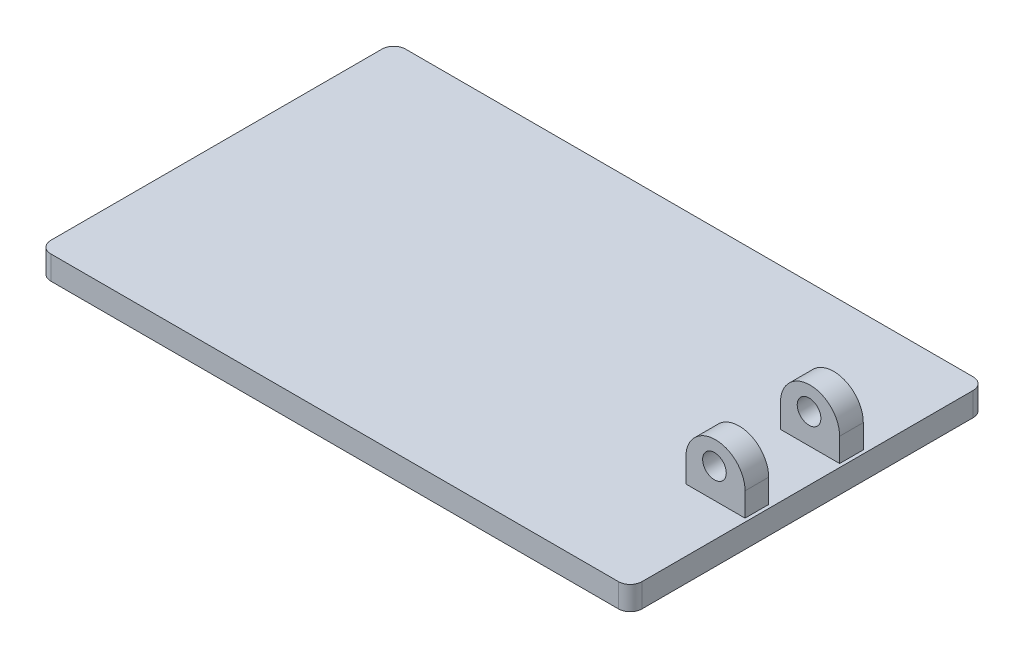
from build123d import *

# Parameters (mm, degrees)
SKETCH1_W           = 500
SKETCH1_H           = 300
BOSS_EXTRUDE1_DEPTH = 20
BOSS_EXTRUDE2_START = -100
BOSS_EXTRUDE2_DEPTH = 20
SKETCH3_R           = 10
CUT_EXTRUDE1_DEPTH  = 286
FILLET1_R           = 10


with BuildPart() as part:
    # Sketch1 → Boss-Extrude1 (new body)
    with BuildSketch(Plane(origin=(0, 0, 0), x_dir=(1, 0, 0), z_dir=(0, 1, 0))):
        Rectangle(SKETCH1_W, SKETCH1_H)
    extrude(amount=BOSS_EXTRUDE1_DEPTH)

    # Sketch2 → Boss-Extrude2 (add)
    with BuildSketch(Plane.XY.offset(150).offset(BOSS_EXTRUDE2_START)):
        with BuildLine():
            Line((197.091467049, 40), (197.091467049, 0))
            Line((197.091467049, 0), (247.091467049, 0))
            Line((247.091467049, 0), (247.091467049, 40))
            ThreePointArc((247.091467049, 40), (222.091467049, 65), (197.091467049, 40))
        make_face()
    boss_extrude2 = extrude(amount=-BOSS_EXTRUDE2_DEPTH)

    # Mirror1: Boss-Extrude2 across plane
    add(boss_extrude2.mirror(Plane.XY))

    # Sketch3 → Cut-Extrude1 (cut)
    with BuildSketch(Plane.XY.offset(50)):
        with Locations(Location((221.220080181, 45.121109354, 0), (0, 0, 180))):
            Circle(SKETCH3_R)
    extrude(amount=-CUT_EXTRUDE1_DEPTH, mode=Mode.SUBTRACT)

    # Fillet1
    fillet1_edges = [part.edges().sort_by_distance(p)[0] for p in [
        (250, 10, 150),
        (-250, 10, 150),
        (-250, 10, -150),
        (250, 10, -150),
    ]]
    fillet(fillet1_edges, radius=FILLET1_R)


solid = part.part
